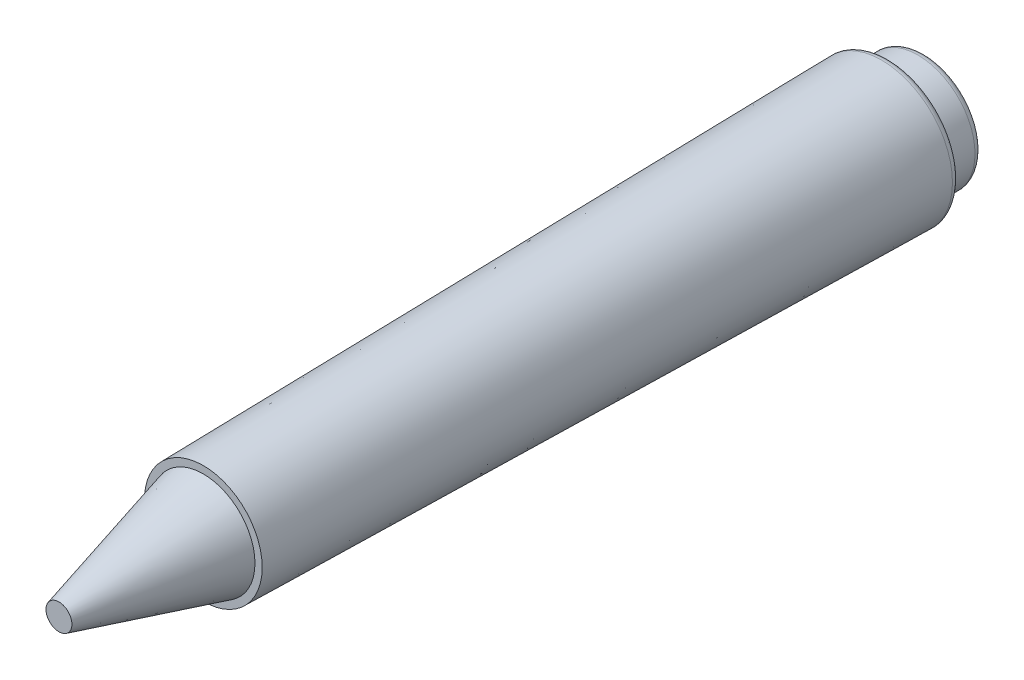
from build123d import *

# Parameters (mm, degrees)
SKETCH_1_R          = 9.9
EXTRUDE_1_DEPTH     = 100
DRAFT_3_ANGLE       = -1
SKETCH_2_R          = 9.9
SKETCH_2_R_2        = 7.9
CUT_EXTRUDE_1_DEPTH = 5
FILLET_1_R          = 1
FILLET_2_R          = 1
SKETCH_5_R          = 7.154493507
EXTRUDE_3_DEPTH     = 20
DRAFT_7_ANGLE       = 15


with BuildPart() as part:
    # 스케치1 → 보스-돌출1 (new body)
    with BuildSketch(Plane.XY):
        Circle(SKETCH_1_R)
    extrude(amount=EXTRUDE_1_DEPTH)

    # 구배3
    draft_3_faces = [part.faces().sort_by_distance(p)[0] for p in [
        (-9.9, 0, 50),
    ]]
    draft(draft_3_faces, Plane(origin=(0, 0, 0), x_dir=(-1, 0, 0), z_dir=(0, 0, -1)), DRAFT_3_ANGLE)

    # 스케치2 → 컷-돌출1 (cut)
    with BuildSketch(Plane(origin=(0, 0, 0), x_dir=(-1, 0, 0), z_dir=(0, 0, -1))):
        Circle(SKETCH_2_R)
        Circle(SKETCH_2_R_2, mode=Mode.SUBTRACT)
    extrude(amount=-CUT_EXTRUDE_1_DEPTH, mode=Mode.SUBTRACT)

    # 필렛1
    fillet_1_edges = [part.edges().sort_by_distance(p)[0] for p in [
        (7.9, 0, 0),
    ]]
    fillet(fillet_1_edges, radius=FILLET_1_R)

    # 필렛2
    fillet_2_edges = [part.edges().sort_by_distance(p)[0] for p in [
        (-9.812724675, 0, 5),
    ]]
    fillet(fillet_2_edges, radius=FILLET_2_R)


with BuildPart() as body_2:
    # 스케치5 → 보스-돌출3 (new body)
    with BuildSketch(Plane.XY.offset(100)):
        Circle(SKETCH_5_R)
    extrude(amount=EXTRUDE_3_DEPTH)

    # 구배7
    draft_7_faces = [body_2.faces().sort_by_distance(p)[0] for p in [
        (-7.154493507, 0, 110),
    ]]
    draft(draft_7_faces, Plane.XY.offset(100), DRAFT_7_ANGLE)


solid = Compound([part.part, body_2.part])
